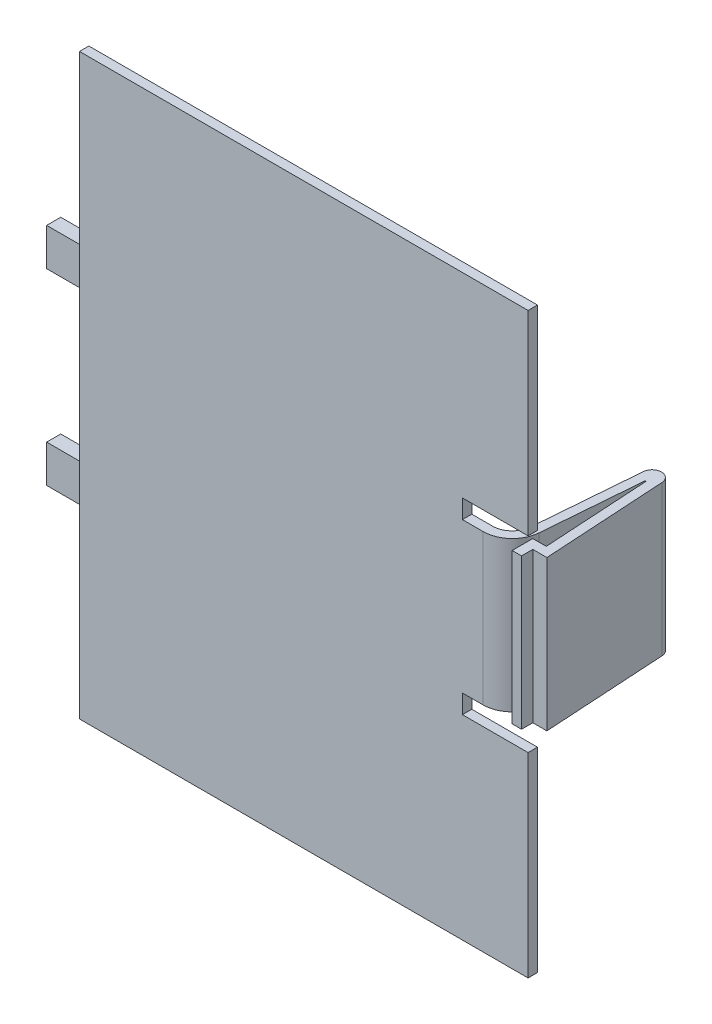
from build123d import *

# Parameters (mm, degrees)
BOSS_EXTRUDE1_DEPTH      = 1
SKETCH2_W                = 9
SKETCH2_H                = 4
BOSS_EXTRUDE2_DEPTH      = 1.5
BOSS_EXTRUDE5_DEPTH      = 8
BOSS_EXTRUDE5_DEPTH_BACK = 8


with BuildPart() as part:
    # Sketch1 → Boss-Extrude1 (new body)
    with BuildSketch(Plane.XY):
        Polygon((-63, -10), (-70, -10), (-70, 10), (-63, 10), (-63, 30.8), (-110.8, 30.8), (-110.8, -30.8), (-63, -30.8), align=None)
    extrude(amount=-BOSS_EXTRUDE1_DEPTH)

    # Sketch2 → Boss-Extrude2 (add)
    with BuildSketch(Plane(origin=(0, 0, -1), x_dir=(-1, 0, 0), z_dir=(0, 0, -1))):
        with Locations((110.8, -10)):
            Rectangle(SKETCH2_W, SKETCH2_H)
        with Locations((110.8, 10)):
            Rectangle(SKETCH2_W, SKETCH2_H)
    extrude(amount=BOSS_EXTRUDE2_DEPTH)

    # Sketch4 → Boss-Extrude5 (add, two sides: drawn at the far end of the back side and taken through both)
    with BuildSketch(Plane(origin=(0, 0, 0), x_dir=(1, 0, 0), z_dir=(0, 1, 0)).offset(-BOSS_EXTRUDE5_DEPTH_BACK)):
        with BuildLine():
            Line((-63.746646239, 13.303022537), (-63.062370045, 2))
            Line((-63.062370045, 2), (-64.5, 2))
            Line((-64.5, 2), (-64.5, -0.2))
            Line((-64.5, -0.2), (-63.5, -0.2))
            Line((-63.5, -0.2), (-63.5, 1))
            Line((-63.5, 1), (-62, 1))
            Line((-62, 1), (-62.790668189, 14.060428588))
            ThreePointArc((-62.790668189, 14.060428588), (-63.7786518, 14.999948092), (-64.785574648, 14.080755571))
            Line((-64.785574648, 14.080755571), (-65.688532626, 2.935903953))
            ThreePointArc((-65.688532626, 2.935903953), (-66.359873651, 1.557863976), (-67.787627389, 1))
            Line((-67.787627389, 1), (-70, 1))
            Line((-70, 1), (-70, 0))
            Line((-70, 0), (-67.787627389, 0))
            ThreePointArc((-67.787627389, 0), (-65.681919218, 0.822760048), (-64.691798691, 2.855148382))
            Line((-64.691798691, 2.855148382), (-63.845228573, 13.304027036))
            ThreePointArc((-63.845228573, 13.304027036), (-63.795469446, 13.349450792), (-63.746646239, 13.303022537))
        make_face()
    extrude(amount=BOSS_EXTRUDE5_DEPTH + BOSS_EXTRUDE5_DEPTH_BACK)


solid = part.part
